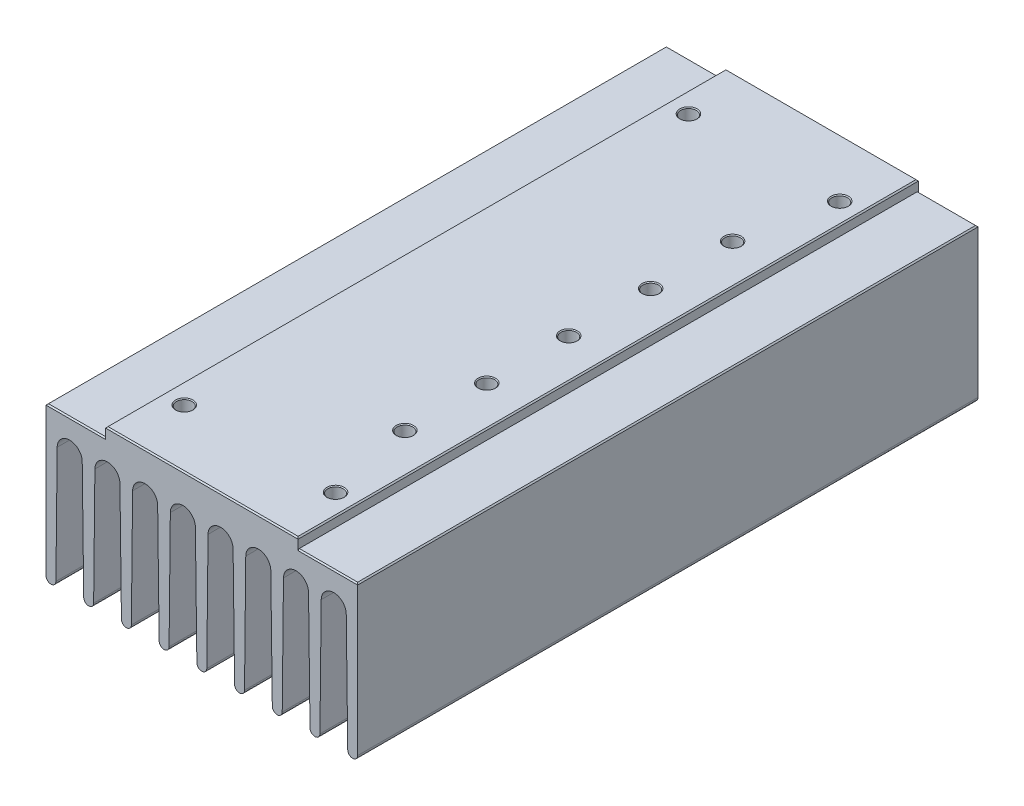
from build123d import *

# Parameters (mm, degrees)
EXTRUDE_1_DEPTH             = 62.5
HOLE_WIZARD_M31_D           = 3.15
HOLE_WIZARD_M31_DEPTH       = 10
HOLE_WIZARD_M31_CSINK_D     = 3.5
HOLE_WIZARD_M31_CSINK_ANGLE = 90
HOLE_WIZARD_M31_TIP         = 0.946355475
CHAMFER_1_SIZE              = 0.25


with BuildPart() as part:
    # Эскиз1 → Бобышка-Вытянуть1 (new, symmetric)
    with BuildSketch(Plane.XY):
        with BuildLine():
            Line((-19.4, 0), (19.4, 0))
            Line((19.4, 0), (19.4, -2))
            Line((19.4, -2), (31.4, -2))
            Line((31.4, -2), (31.4, -6.000517486))
            Line((31.4, -6.000517486), (31.4, -32))
            ThreePointArc((31.4, -32), (30.406376534, -32.99997967), (29.40008132, -32.012752808))
            Line((29.40008132, -32.012752808), (29.099793084, -8.467834553))
            ThreePointArc((29.099793084, -8.467834553), (26.573234779, -5.975854204), (24.051798919, -8.473017422))
            Line((24.051798919, -8.473017422), (23.799942759, -32.010699513))
            ThreePointArc((23.799942759, -32.010699513), (22.801026718, -32.999999473), (21.80008132, -32.012752808))
            Line((21.80008132, -32.012752808), (21.499793084, -8.467834553))
            ThreePointArc((21.499793084, -8.467834553), (18.973234779, -5.975854204), (16.451798919, -8.473017422))
            Line((16.451798919, -8.473017422), (16.199942759, -32.010699513))
            ThreePointArc((16.199942759, -32.010699513), (15.201026718, -32.999999473), (14.20008132, -32.012752808))
            Line((14.20008132, -32.012752808), (13.899793084, -8.467834553))
            ThreePointArc((13.899793084, -8.467834553), (11.373234779, -5.975854204), (8.851798919, -8.473017422))
            Line((8.851798919, -8.473017422), (8.599942759, -32.010699513))
            ThreePointArc((8.599942759, -32.010699513), (7.601026718, -32.999999473), (6.60008132, -32.012752808))
            Line((6.60008132, -32.012752808), (6.299793084, -8.467834553))
            ThreePointArc((6.299793084, -8.467834553), (3.773234779, -5.975854204), (1.251798919, -8.473017422))
            Line((1.251798919, -8.473017422), (0.999942759, -32.010699513))
            ThreePointArc((0.999942759, -32.010699513), (0.001026718, -32.999999473), (-0.99991868, -32.012752808))
            Line((-0.99991868, -32.012752808), (-1.300206916, -8.467834553))
            ThreePointArc((-1.300206916, -8.467834553), (-3.826765221, -5.975854204), (-6.348201081, -8.473017422))
            Line((-6.348201081, -8.473017422), (-6.600057241, -32.010699513))
            ThreePointArc((-6.600057241, -32.010699513), (-7.598973282, -32.999999473), (-8.59991868, -32.012752808))
            Line((-8.59991868, -32.012752808), (-8.900206916, -8.467834553))
            ThreePointArc((-8.900206916, -8.467834553), (-11.426765221, -5.975854204), (-13.948201081, -8.473017422))
            Line((-13.948201081, -8.473017422), (-14.200057241, -32.010699513))
            ThreePointArc((-14.200057241, -32.010699513), (-15.198973282, -32.999999473), (-16.19991868, -32.012752808))
            Line((-16.19991868, -32.012752808), (-16.500206916, -8.467834553))
            ThreePointArc((-16.500206916, -8.467834553), (-19.026765221, -5.975854204), (-21.548201081, -8.473017422))
            Line((-21.548201081, -8.473017422), (-21.800057241, -32.010699513))
            ThreePointArc((-21.800057241, -32.010699513), (-22.798973282, -32.999999473), (-23.79991868, -32.012752808))
            Line((-23.79991868, -32.012752808), (-24.100206916, -8.467834553))
            ThreePointArc((-24.100206916, -8.467834553), (-26.626765221, -5.975854204), (-29.148201081, -8.473017422))
            Line((-29.148201081, -8.473017422), (-29.400057241, -32.010699513))
            ThreePointArc((-29.400057241, -32.010699513), (-30.405349833, -32.99998569), (-31.4, -32))
            Line((-31.4, -32), (-31.4, -6.000517486))
            Line((-31.4, -6.000517486), (-31.4, -2))
            Line((-31.4, -2), (-19.4, -2))
            Line((-19.4, -2), (-19.4, 0))
        make_face()
    extrude(amount=EXTRUDE_1_DEPTH, both=True)

    # Сверло под метчик  спиральное M31
    with Locations(Plane(origin=(0, 0, 0), x_dir=(1, 0, 0), z_dir=(0, 1, 0))):
        with Locations((11.43, 0), (11.43, -16.51), (11.43, -33.02), (11.43, 16.51), (11.43, 33.02), (15.24, 50.8), (-15.24, 50.8), (-15.24, -50.8), (15.24, -50.8)):
            CounterSinkHole(HOLE_WIZARD_M31_D / 2, HOLE_WIZARD_M31_CSINK_D / 2, depth=HOLE_WIZARD_M31_DEPTH, counter_sink_angle=HOLE_WIZARD_M31_CSINK_ANGLE)
            with Locations((0, 0, -(HOLE_WIZARD_M31_DEPTH + HOLE_WIZARD_M31_TIP / 2))):  # 118° drill point
                Cone(0, HOLE_WIZARD_M31_D / 2, HOLE_WIZARD_M31_TIP, mode=Mode.SUBTRACT)

    # Фаска1
    chamfer_1_edges = [part.edges().sort_by_distance(p)[0] for p in [
        (25.4, -2, -62.5),
        (0, 0, -62.5),
        (0, 0, 62.5),
        (25.4, -2, 62.5),
        (-25.4, -2, -62.5),
        (-25.4, -2, 62.5),
        (-19.4, 0, 0),
        (19.4, 0, 0),
        (31.4, -2, 0),
        (-31.4, -2, 0),
    ]]
    chamfer(chamfer_1_edges, length=CHAMFER_1_SIZE)


solid = part.part
